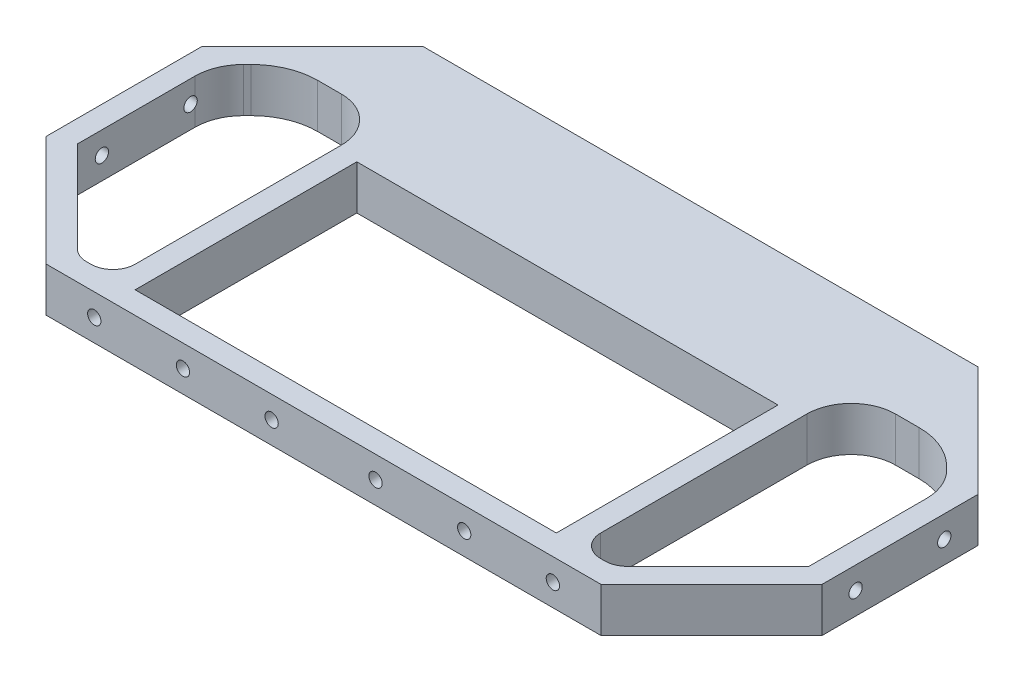
from build123d import *

# Parameters (mm, degrees)
EXTRUDE_1_DEPTH     = 10
FILLET_1_R          = 10
FILLET_11_R         = 5
FILLET_21_R         = 15
FILLET_24_R         = 11
SKETCH_5_R          = 1.5
CUT_EXTRUDE_1_DEPTH = 6
SKETCH_2_R          = 1.5
CUT_EXTRUDE_2_DEPTH = 6
CUT_EXTRUDE_START   = -6
SKETCH_3_R          = 1.5
CUT_EXTRUDE_3_DEPTH = 6
SKETCH_4_R          = 1.5
CUT_EXTRUDE_4_DEPTH = 6


with BuildPart() as part:
    # 草图1 → 凸台-拉伸1 (new body)
    with BuildSketch(Plane(origin=(0, 0, 0), x_dir=(1, 0, 0), z_dir=(0, 1, 0))):
        Polygon((73.431457505, 42.5), (16.568542495, 42.5), (-17.604076401, 42.5), (-42.5, 17.604076401), (-42.5, -17.604076401), (-17.604076401, -42.5), (16.568542495, -42.5), (73.431457505, -42.5), (107.604076401, -42.5), (132.5, -17.604076401), (132.5, 17.604076401), (107.604076401, 42.5), align=None)
        Polygon((-37.5, 15.533008589), (-29.033008589, 24), (-7.5, 24), (-7.5, -37.5), (-15.533008589, -37.5), (-37.5, -15.533008589), align=None, mode=Mode.SUBTRACT)
        Polygon((19.068542495, -37.5), (16.568542495, -37.5), (6.858116823, -37.5), (-2.5, -37.5), (-2.5, -28), (-2.5, 12.5), (92.5, 12.5), (92.5, -28), (92.5, -37.5), (83.141883177, -37.5), (73.431457505, -37.5), align=None, mode=Mode.SUBTRACT)
        Polygon((97.5, 24), (119.033008589, 24), (127.5, 15.533008589), (127.5, -15.533008589), (105.533008589, -37.5), (97.5, -37.5), align=None, mode=Mode.SUBTRACT)
    extrude(amount=EXTRUDE_1_DEPTH)

    # 圆角1
    fillet_1_edges = [part.edges().sort_by_distance(p)[0] for p in [
        (-7.5, 5, -24),
        (97.5, 5, -24),
    ]]
    fillet(fillet_1_edges, radius=FILLET_1_R)

    # 圆角11
    fillet_11_edges = [part.edges().sort_by_distance(p)[0] for p in [
        (-15.533008589, 5, 37.5),
        (-7.5, 5, 37.5),
        (97.5, 5, 37.5),
        (105.533008589, 5, 37.5),
    ]]
    fillet(fillet_11_edges, radius=FILLET_11_R)

    # 圆角21
    fillet_21_edges = [part.edges().sort_by_distance(p)[0] for p in [
        (-29.033008589, 5, -24),
        (119.033008589, 5, -24),
    ]]
    fillet(fillet_21_edges, radius=FILLET_21_R)

    # 圆角24
    fillet_24_edges = [part.edges().sort_by_distance(p)[0] for p in [
        (-37.5, 5, -15.533008589),
        (127.5, 5, -15.533008589),
    ]]
    fillet(fillet_24_edges, radius=FILLET_24_R)

    # 草图5 → 切除-拉伸1 (cut)
    with BuildSketch(Plane.ZY.offset(42.5)):
        with Locations((10, 5)):
            Circle(SKETCH_5_R)
        with Locations((-10, 5)):
            Circle(SKETCH_5_R)
    extrude(amount=-CUT_EXTRUDE_1_DEPTH, mode=Mode.SUBTRACT)

    # 草图2 → 切除-拉伸2 (cut)
    with BuildSketch(Plane(origin=(0, 0, -42.5), x_dir=(-1, 0, 0), z_dir=(0, 0, -1))):
        with Locations((-33.281955929, 5)):
            Circle(SKETCH_2_R)
        with Locations((-13.281955929, 5)):
            Circle(SKETCH_2_R)
        with Locations((6.718044071, 5)):
            Circle(SKETCH_2_R)
        with Locations(Location((-96.718044071, 5, 0), (0, 0, 180))):
            Circle(SKETCH_2_R)
        with Locations(Location((-76.718044071, 5, 0), (0, 0, 180))):
            Circle(SKETCH_2_R)
        with Locations(Location((-56.718044071, 5, 0), (0, 0, 180))):
            Circle(SKETCH_2_R)
    extrude(amount=-CUT_EXTRUDE_2_DEPTH, mode=Mode.SUBTRACT)

    # 草图3 → 切除-拉伸3 (cut)
    with BuildSketch(Plane(origin=(132.5, 0, 0), x_dir=(0, 0, -1), z_dir=(1, 0, 0)).offset(CUT_EXTRUDE_START)):
        with Locations(Location((10, 5, 0), (0, 0, 180))):
            Circle(SKETCH_3_R)
        with Locations(Location((-10, 5, 0), (0, 0, 180))):
            Circle(SKETCH_3_R)
    extrude(amount=CUT_EXTRUDE_3_DEPTH, mode=Mode.SUBTRACT)

    # 草图4 → 切除-拉伸4 (cut)
    with BuildSketch(Plane.XY.offset(42.5).offset(CUT_EXTRUDE_START)):
        with Locations((56.718044071, 5)):
            Circle(SKETCH_4_R)
        with Locations((76.718044071, 5)):
            Circle(SKETCH_4_R)
        with Locations((96.718044071, 5)):
            Circle(SKETCH_4_R)
        with Locations(Location((33.281955929, 5, 0), (0, 0, 180))):
            Circle(SKETCH_4_R)
        with Locations(Location((13.281955929, 5, 0), (0, 0, 180))):
            Circle(SKETCH_4_R)
        with Locations(Location((-6.718044071, 5, 0), (0, 0, 180))):
            Circle(SKETCH_4_R)
    extrude(amount=CUT_EXTRUDE_4_DEPTH, mode=Mode.SUBTRACT)


solid = part.part
